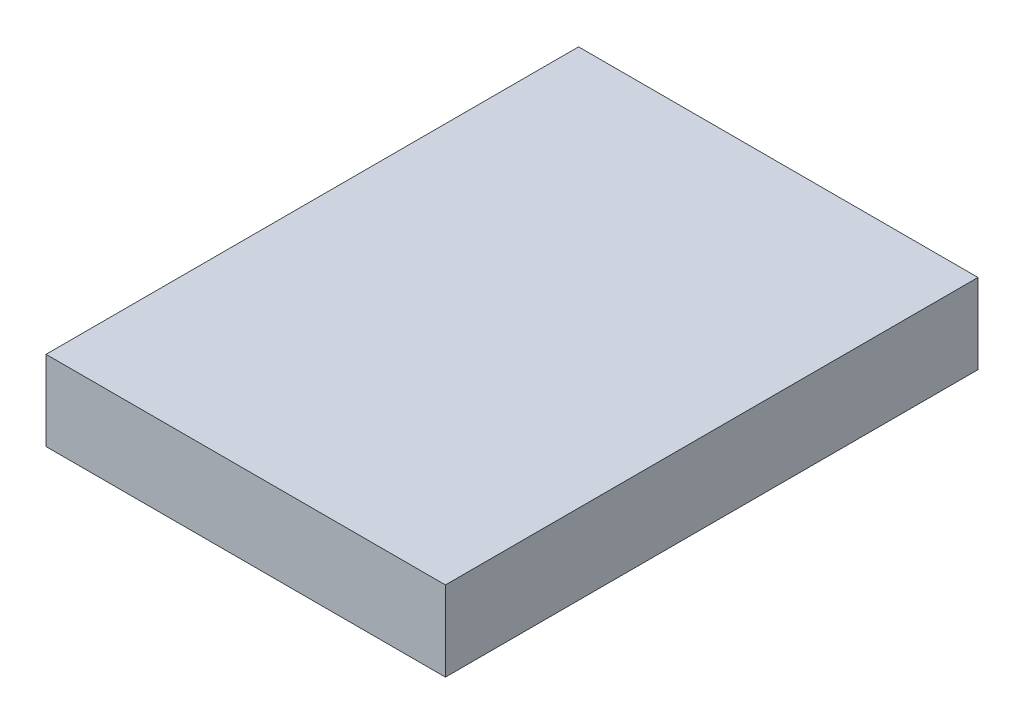
from build123d import *

# Parameters (mm, degrees)
SKETCH1_W           = 75
SKETCH1_H           = 15
BOSS_EXTRUDE1_DEPTH = 50


with BuildPart() as part:
    # Sketch1 → Boss-Extrude1 (new, symmetric)
    with BuildSketch(Plane.XY):
        Rectangle(SKETCH1_W, SKETCH1_H)
    extrude(amount=BOSS_EXTRUDE1_DEPTH, both=True)


solid = part.part
